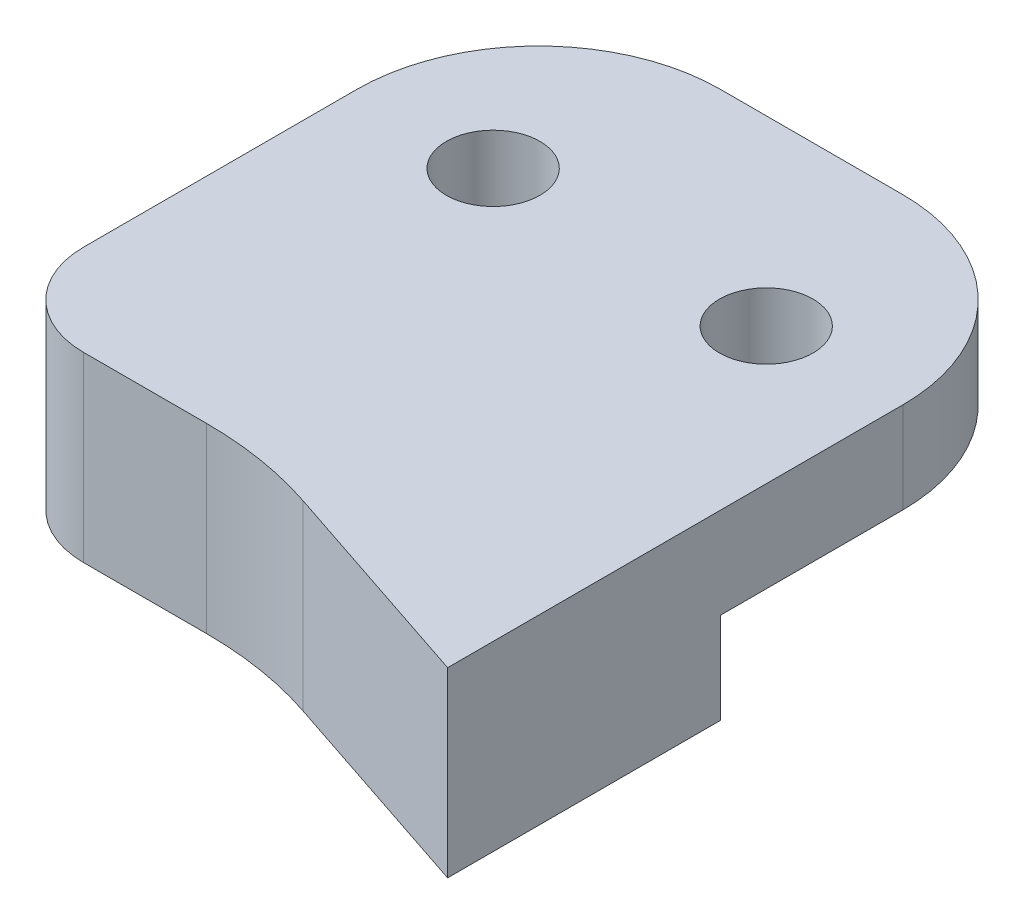
from build123d import *

# Parameters (mm, degrees)
SKETCH1_R           = 3.2639
BOSS_EXTRUDE1_DEPTH = 6.35
BOSS_EXTRUDE2_START = -6.35
BOSS_EXTRUDE2_DEPTH = 6.35
FILLET1_R           = 6.35
FILLET2_R           = 12.7


with BuildPart() as part:
    # Sketch1 → Boss-Extrude1 (new body)
    with BuildSketch(Plane(origin=(0, 0, 0), x_dir=(1, 0, 0), z_dir=(0, 1, 0))):
        with BuildLine():
            Line((-19.05, 19.05), (-19.05, -19.05))
            Line((-19.05, -19.05), (-4.121852568, -19.05))
            ThreePointArc((-4.121852568, -19.05), (-0.053223596, -19.377978576), (3.910332689, -20.35344423))
            Line((3.910332689, -20.35344423), (19.05, -25.4))
            Line((19.05, -25.4), (19.05, 19.05))
            Line((19.05, 19.05), (-19.05, 19.05))
        make_face()
        with Locations((-9.525, 6.35)):
            Circle(SKETCH1_R, mode=Mode.SUBTRACT)
        with Locations((9.525, 6.35)):
            Circle(SKETCH1_R, mode=Mode.SUBTRACT)
    extrude(amount=BOSS_EXTRUDE1_DEPTH)

    # Sketch1<7> → Boss-Extrude2 (add)
    with BuildSketch(Plane(origin=(0, 0, 0), x_dir=(1, 0, 0), z_dir=(0, 1, 0)).offset(BOSS_EXTRUDE2_START)):
        with BuildLine():
            Line((19.05, -6.35), (-19.05, -6.35))
            Line((-19.05, -6.35), (-19.05, -19.05))
            Line((-19.05, -19.05), (-4.121852568, -19.05))
            ThreePointArc((-4.121852568, -19.05), (-0.053223596, -19.377978576), (3.910332689, -20.35344423))
            Line((3.910332689, -20.35344423), (19.05, -25.4))
            Line((19.05, -25.4), (19.05, -19.05))
            Line((19.05, -19.05), (19.05, -6.35))
        make_face()
    extrude(amount=BOSS_EXTRUDE2_DEPTH)

    # Fillet1
    fillet1_edges = [part.edges().sort_by_distance(p)[0] for p in [
        (-19.05, 0, 19.05),
    ]]
    fillet(fillet1_edges, radius=FILLET1_R)

    # Fillet2
    fillet2_edges = [part.edges().sort_by_distance(p)[0] for p in [
        (19.05, 3.175, -19.05),
        (-19.05, 3.175, -19.05),
    ]]
    fillet(fillet2_edges, radius=FILLET2_R)


solid = part.part
